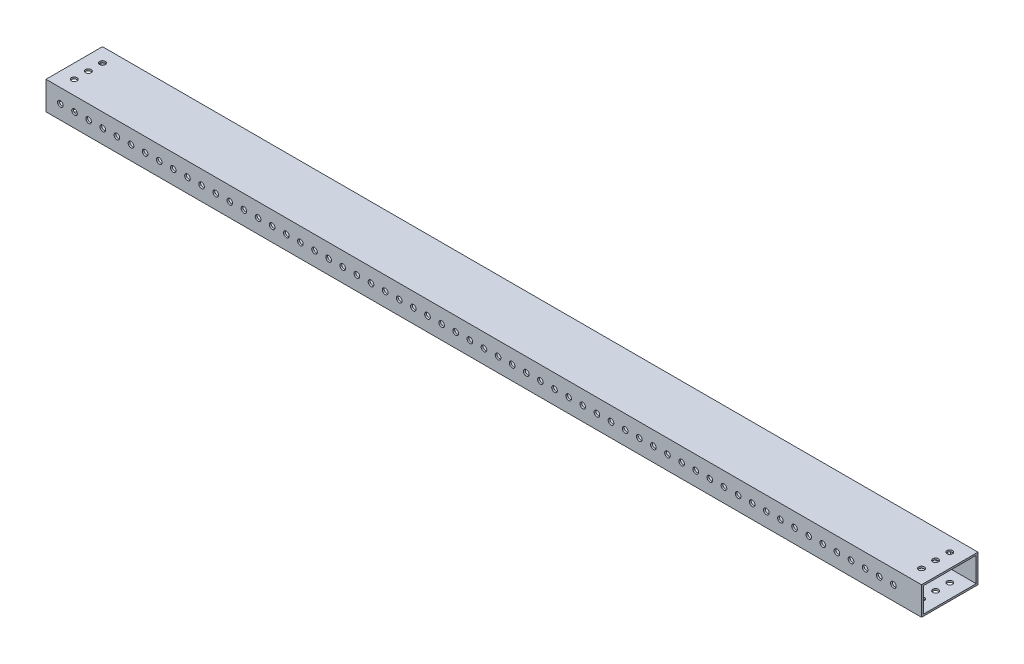
from build123d import *

# Parameters (mm, degrees)
SKETCH1_W           = 787.580141844
SKETCH1_H           = 50.8
BOSS_EXTRUDE1_DEPTH = 25.4
SKETCH2_W           = 47.577219443
SKETCH2_H           = 22.157059011
CUT_EXTRUDE1_DEPTH  = 789.398883705
SKETCH3_R           = 2.54
CUT_EXTRUDE2_DEPTH  = 398.864826237
SKETCH4_R           = 2.54
CUT_EXTRUDE3_DEPTH  = 396.4250118


with BuildPart() as part:
    # Sketch1 → Boss-Extrude1 (new body)
    with BuildSketch(Plane(origin=(0, 0, 0), x_dir=(1, 0, 0), z_dir=(0, 1, 0))):
        Rectangle(SKETCH1_W, SKETCH1_H)
    extrude(amount=BOSS_EXTRUDE1_DEPTH)

    # Sketch2 → Cut-Extrude1 (cut, through all)
    with BuildSketch(Plane.ZY.offset(393.790070922)):
        with Locations((0.005055824, 12.705024393)):
            Rectangle(SKETCH2_W, SKETCH2_H)
    extrude(amount=-CUT_EXTRUDE1_DEPTH, mode=Mode.SUBTRACT)

    # Sketch3 → Cut-Extrude2 (cut, through all)
    with BuildSketch(Plane.XY.offset(25.4)):
        with Locations((-380.836070922, 12.7)):
            Circle(SKETCH3_R)
        with Locations((-368.136070922, 12.7)):
            Circle(SKETCH3_R)
        with Locations((-355.436070922, 12.7)):
            Circle(SKETCH3_R)
        with Locations((-342.736070922, 12.7)):
            Circle(SKETCH3_R)
        with Locations((-330.036070922, 12.7)):
            Circle(SKETCH3_R)
        with Locations((-317.336070922, 12.7)):
            Circle(SKETCH3_R)
        with Locations((-304.636070922, 12.7)):
            Circle(SKETCH3_R)
        with Locations((-291.936070922, 12.7)):
            Circle(SKETCH3_R)
        with Locations((-279.236070922, 12.7)):
            Circle(SKETCH3_R)
        with Locations((-266.536070922, 12.7)):
            Circle(SKETCH3_R)
        with Locations((-253.836070922, 12.7)):
            Circle(SKETCH3_R)
        with Locations((-241.136070922, 12.7)):
            Circle(SKETCH3_R)
        with Locations((-228.436070922, 12.7)):
            Circle(SKETCH3_R)
        with Locations((-215.736070922, 12.7)):
            Circle(SKETCH3_R)
        with Locations((-203.036070922, 12.7)):
            Circle(SKETCH3_R)
        with Locations((-190.336070922, 12.7)):
            Circle(SKETCH3_R)
        with Locations((-177.636070922, 12.7)):
            Circle(SKETCH3_R)
        with Locations((-164.936070922, 12.7)):
            Circle(SKETCH3_R)
        with Locations((-152.236070922, 12.7)):
            Circle(SKETCH3_R)
        with Locations((-139.536070922, 12.7)):
            Circle(SKETCH3_R)
        with Locations((-126.836070922, 12.7)):
            Circle(SKETCH3_R)
        with Locations((-114.136070922, 12.7)):
            Circle(SKETCH3_R)
        with Locations((-101.436070922, 12.7)):
            Circle(SKETCH3_R)
        with Locations((-88.736070922, 12.7)):
            Circle(SKETCH3_R)
        with Locations((-76.036070922, 12.7)):
            Circle(SKETCH3_R)
        with Locations((-63.336070922, 12.7)):
            Circle(SKETCH3_R)
        with Locations((-50.636070922, 12.7)):
            Circle(SKETCH3_R)
        with Locations((-37.936070922, 12.7)):
            Circle(SKETCH3_R)
        with Locations((-25.236070922, 12.7)):
            Circle(SKETCH3_R)
        with Locations((-12.536070922, 12.7)):
            Circle(SKETCH3_R)
        with Locations((0.163929078, 12.7)):
            Circle(SKETCH3_R)
        with Locations((12.863929078, 12.7)):
            Circle(SKETCH3_R)
        with Locations((25.563929078, 12.7)):
            Circle(SKETCH3_R)
        with Locations((38.263929078, 12.7)):
            Circle(SKETCH3_R)
        with Locations((50.963929078, 12.7)):
            Circle(SKETCH3_R)
        with Locations((63.663929078, 12.7)):
            Circle(SKETCH3_R)
        with Locations((76.363929078, 12.7)):
            Circle(SKETCH3_R)
        with Locations((89.063929078, 12.7)):
            Circle(SKETCH3_R)
        with Locations((101.763929078, 12.7)):
            Circle(SKETCH3_R)
        with Locations((114.463929078, 12.7)):
            Circle(SKETCH3_R)
        with Locations((127.163929078, 12.7)):
            Circle(SKETCH3_R)
        with Locations((139.863929078, 12.7)):
            Circle(SKETCH3_R)
        with Locations((152.563929078, 12.7)):
            Circle(SKETCH3_R)
        with Locations((165.263929078, 12.7)):
            Circle(SKETCH3_R)
        with Locations((177.963929078, 12.7)):
            Circle(SKETCH3_R)
        with Locations((190.663929078, 12.7)):
            Circle(SKETCH3_R)
        with Locations((203.363929078, 12.7)):
            Circle(SKETCH3_R)
        with Locations((216.063929078, 12.7)):
            Circle(SKETCH3_R)
        with Locations((228.763929078, 12.7)):
            Circle(SKETCH3_R)
        with Locations((241.463929078, 12.7)):
            Circle(SKETCH3_R)
        with Locations((254.163929078, 12.7)):
            Circle(SKETCH3_R)
        with Locations((266.863929078, 12.7)):
            Circle(SKETCH3_R)
        with Locations((279.563929078, 12.7)):
            Circle(SKETCH3_R)
        with Locations((292.263929078, 12.7)):
            Circle(SKETCH3_R)
        with Locations((304.963929078, 12.7)):
            Circle(SKETCH3_R)
        with Locations((317.663929078, 12.7)):
            Circle(SKETCH3_R)
        with Locations((330.363929078, 12.7)):
            Circle(SKETCH3_R)
        with Locations((343.063929078, 12.7)):
            Circle(SKETCH3_R)
        with Locations((355.763929078, 12.7)):
            Circle(SKETCH3_R)
        with Locations((368.463929078, 12.7)):
            Circle(SKETCH3_R)
    extrude(amount=-CUT_EXTRUDE2_DEPTH, mode=Mode.SUBTRACT)

    # Sketch4 → Cut-Extrude3 (cut, through all)
    with BuildSketch(Plane(origin=(0, 25.4, 0), x_dir=(1, 0, 0), z_dir=(0, 1, 0))):
        with Locations(Location((-381.090070922, 12.7, 0), (0, 0, 270))):
            Circle(SKETCH4_R)
        with Locations(Location((-381.090070922, -12.7, 0), (0, 0, 270))):
            Circle(SKETCH4_R)
        with Locations(Location((-381.090070922, 0, 0), (0, 0, 270))):
            Circle(SKETCH4_R)
        with Locations(Location((381.090070922, 12.7, 0), (0, 0, 270))):
            Circle(SKETCH4_R)
        with Locations(Location((381.090070922, 0, 0), (0, 0, 270))):
            Circle(SKETCH4_R)
        with Locations(Location((381.090070922, -12.7, 0), (0, 0, 270))):
            Circle(SKETCH4_R)
    extrude(amount=-CUT_EXTRUDE3_DEPTH, mode=Mode.SUBTRACT)


solid = part.part
